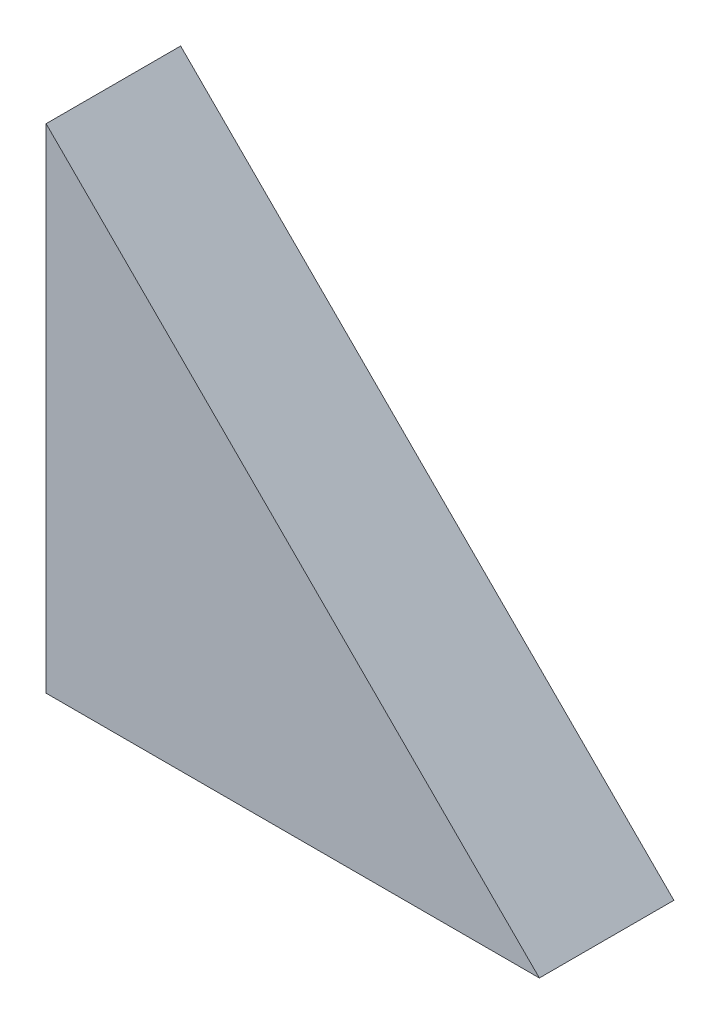
from build123d import *

# Parameters (mm, degrees)
SALIENTE_EXTRUIR1_DEPTH = 1.5


with BuildPart() as part:
    # Croquis1 → Saliente-Extruir1 (new, symmetric)
    with BuildSketch(Plane.XY):
        Polygon((0, 0), (0, 11), (11, 0), align=None)
    extrude(amount=SALIENTE_EXTRUIR1_DEPTH, both=True)


solid = part.part
